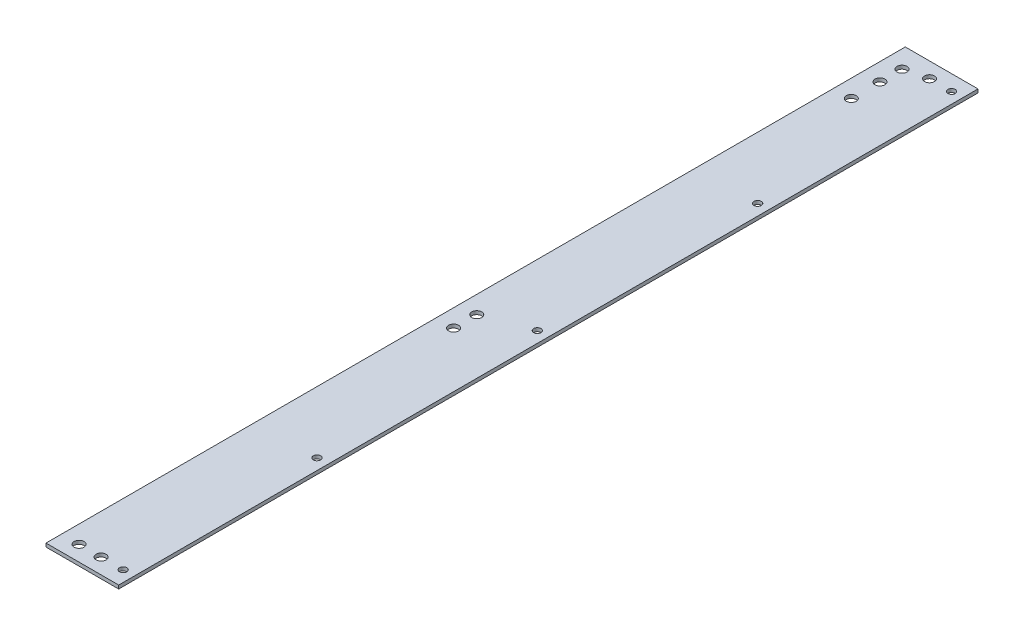
from build123d import *

# Parameters (mm, degrees)
SKETCH1_W             = 33
SKETCH1_H             = 390
BOSS_EXTRUDE1_DEPTH   = 1.5875
M4_CLEARANCE_HOLE1_D  = 4.5
M4X0_7_TAPPED_HOLE1_D = 3.3


with BuildPart() as part:
    # Sketch1 → Boss-Extrude1 (new body)
    with BuildSketch(Plane(origin=(0, 0, 0), x_dir=(1, 0, 0), z_dir=(0, 1, 0))):
        Rectangle(SKETCH1_W, SKETCH1_H)
    extrude(amount=BOSS_EXTRUDE1_DEPTH)

    # M4 Clearance Hole1 (through all)
    with Locations(Plane(origin=(0, 1.5875, 0), x_dir=(1, 0, 0), z_dir=(0, 1, 0))):
        with Locations((1.5, 188), (-8.5, 185.5), (-8.5, 175.5), (-8.5, 162.5), (-8.5, -7.5), (-8.5, -18), (-8.5, -188), (1.5, -188)):
            Hole(M4_CLEARANCE_HOLE1_D / 2)

    # M4x0.7 Tapped Hole1 (through all)
    with Locations(Plane(origin=(0, 1.5875, 0), x_dir=(1, 0, 0), z_dir=(0, 1, 0))):
        with Locations((11.5, 188), (11.5, -188), (11.5, 100), (11.5, -100), (11.5, 0)):
            Hole(M4X0_7_TAPPED_HOLE1_D / 2)


solid = part.part
